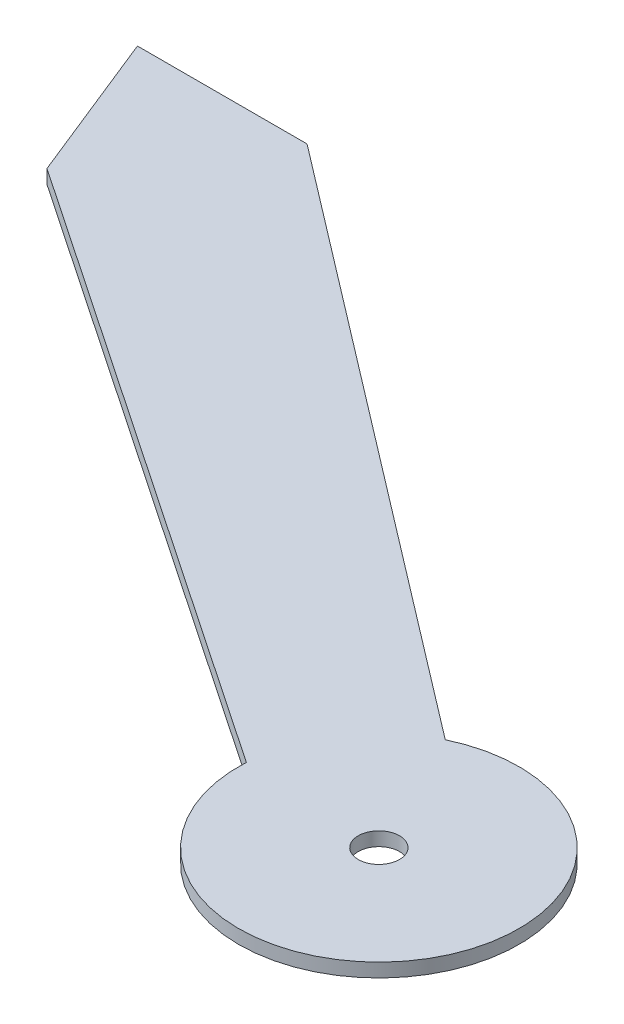
from build123d import *

# Parameters (mm, degrees)
SKETCH1_R           = 0.15
BOSS_EXTRUDE1_DEPTH = 0.1
BOSS_EXTRUDE3_DEPTH = 0.02


with BuildPart() as part:
    # Sketch1 → Boss-Extrude1 (new body)
    with BuildSketch(Plane(origin=(0, 0, 0), x_dir=(1, 0, 0), z_dir=(0, 1, 0))):
        with BuildLine():
            Line((-5.928976917, 4.17249718), (-5.486197441, 3.071413653))
            Line((-5.486197441, 3.071413653), (-1.019009626, 0.054984583))
            ThreePointArc((-1.019009626, 0.054984583), (0.847824795, -0.567976267), (-0.438539423, 0.921459222))
            Line((-0.438539423, 0.921459222), (-4.694959938, 4.17249718))
            Line((-4.694959938, 4.17249718), (-5.928976917, 4.17249718))
        make_face()
        with Locations(Location((0, 0, 0), (0, 0, 270))):
            Circle(SKETCH1_R, mode=Mode.SUBTRACT)
        Polygon((-5.486197441, 3.860892642), (-5.216856249, 3.271495682), (-2.200234898, 1.239893548), (-1.948613115, 1.613513771), (-4.890993257, 3.860892642), align=None, mode=Mode.SUBTRACT)
    extrude(amount=BOSS_EXTRUDE1_DEPTH)

    # Sketch3 → Boss-Extrude3 (add)
    with BuildSketch(Plane(origin=(0, 0.1, 0), x_dir=(1, 0, 0), z_dir=(0, 1, 0))):
        Polygon((-5.669795802, 4.060835761), (-4.60725372, 3.952218978), (-1.551568417, 1.529417339), (-2.04496188, 0.980620035), (-5.388394983, 3.169960387), align=None)
    extrude(amount=-BOSS_EXTRUDE3_DEPTH)


solid = part.part
